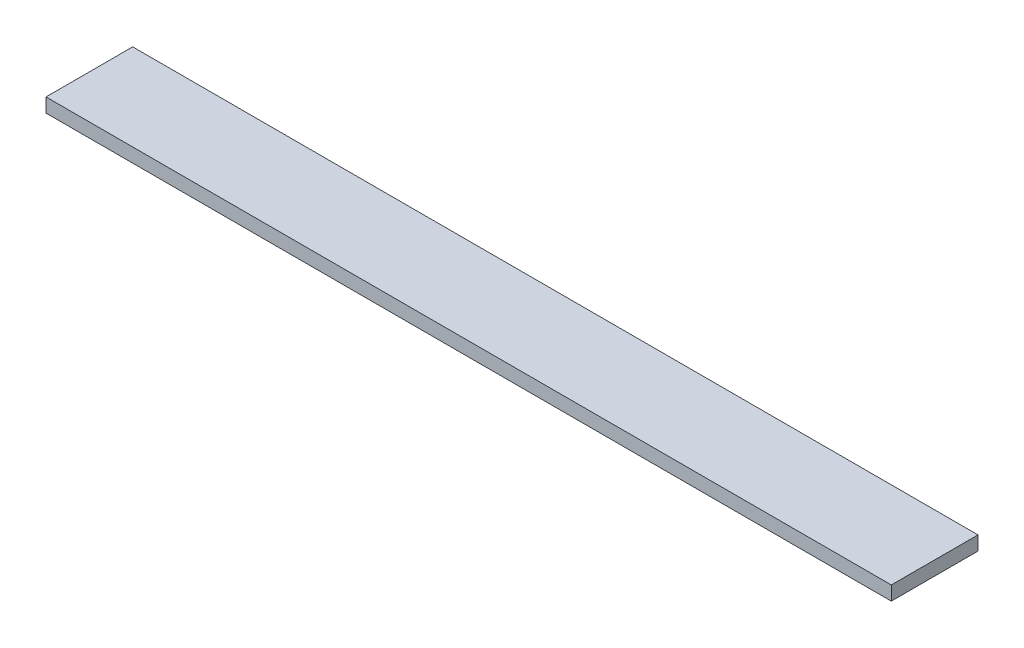
from build123d import *

# Parameters (mm, degrees)
SKETCH1_W           = 1300.1625
SKETCH1_H           = 133.35
BOSS_EXTRUDE1_DEPTH = 21.59


with BuildPart() as part:
    # Sketch1 → Boss-Extrude1 (new body)
    with BuildSketch(Plane(origin=(0, 0, 0), x_dir=(1, 0, 0), z_dir=(0, 1, 0))):
        with Locations((-4.285047348, 171.947296402)):
            Rectangle(SKETCH1_W, SKETCH1_H)
    extrude(amount=BOSS_EXTRUDE1_DEPTH)


solid = part.part
